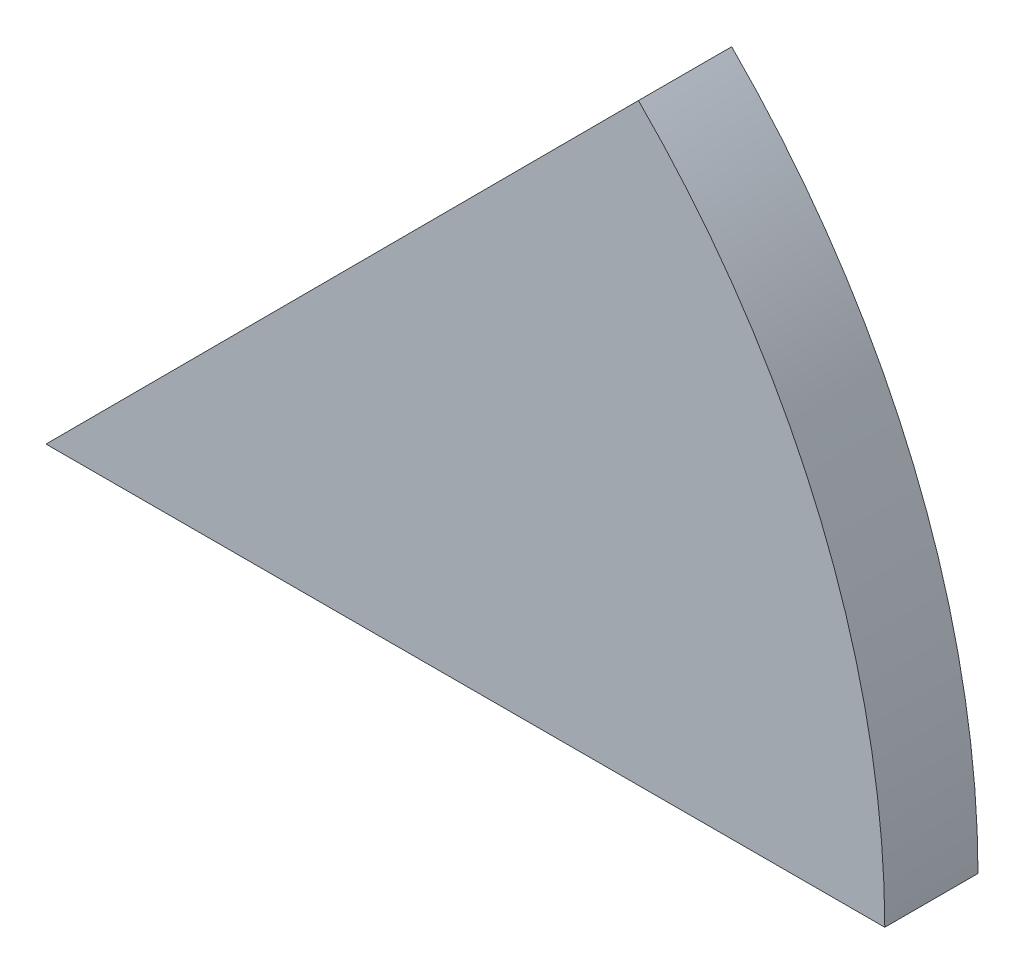
from build123d import *

# Parameters (mm, degrees)
EXTRUDE1_DEPTH = 25.4


with BuildPart() as part:
    # Sketch1 → Extrude1 (new body)
    with BuildSketch(Plane.XY):
        with BuildLine():
            Line((0, 0), (228.599862879, 0.250383201))
            ThreePointArc((228.599862879, 0.250383201), (211.102916946, 87.71270408), (161.46746556, 161.82156088))
            Line((161.46746556, 161.82156088), (0, 0))
        make_face()
    extrude(amount=EXTRUDE1_DEPTH)


solid = part.part
